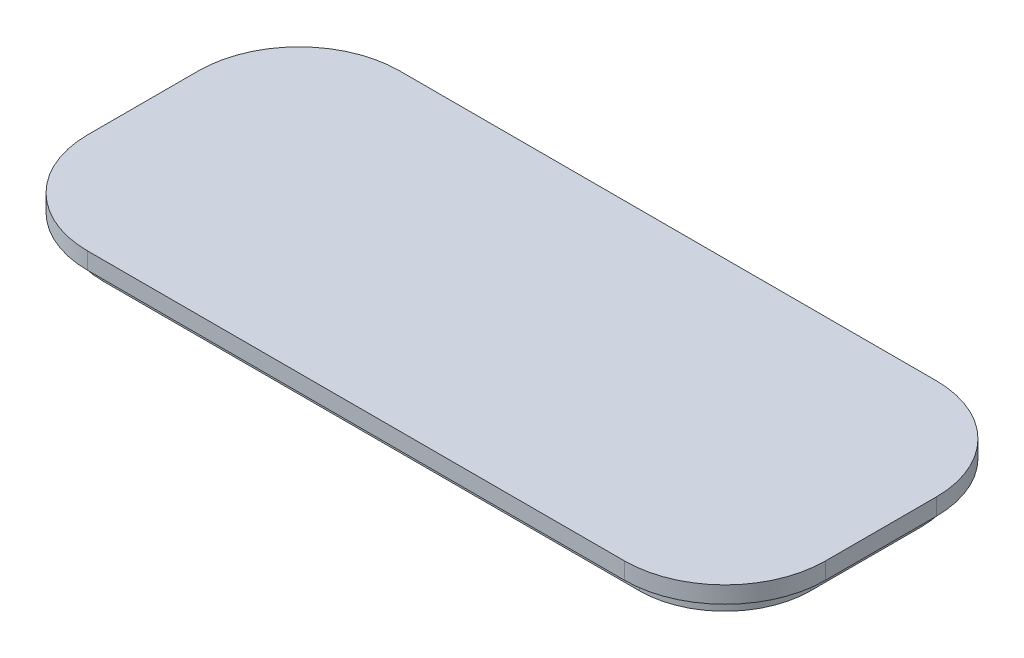
from build123d import *

# Parameters (mm, degrees)
SKETCH_1_W      = 220
SKETCH_1_H      = 93
EXTRUDE_1_DEPTH = 5
FILLET_1_R      = 30
EXTRUDE_2_DEPTH = 5


with BuildPart() as part:
    # 草圖1 → 填料-伸長1 (new body)
    with BuildSketch(Plane(origin=(0, 0, 0), x_dir=(1, 0, 0), z_dir=(0, 1, 0))):
        Rectangle(SKETCH_1_W, SKETCH_1_H)
    extrude(amount=EXTRUDE_1_DEPTH)

    # 圓角1
    fillet_1_edges = [part.edges().sort_by_distance(p)[0] for p in [
        (110, 2.5, 46.5),
        (-110, 2.5, 46.5),
        (-110, 2.5, -46.5),
        (110, 2.5, -46.5),
    ]]
    fillet(fillet_1_edges, radius=FILLET_1_R)

    # 草圖2 → 填料-伸長2 (add)
    with BuildSketch(Plane.XZ):
        with BuildLine():
            Line((-80, -42), (80, -42))
            ThreePointArc((80, -42), (98.03122292, -34.53122292), (105.5, -16.5))
            Line((105.5, -16.5), (105.5, 16.5))
            ThreePointArc((105.5, 16.5), (98.03122292, 34.53122292), (80, 42))
            Line((80, 42), (-80, 42))
            ThreePointArc((-80, 42), (-98.03122292, 34.53122292), (-105.5, 16.5))
            Line((-105.5, 16.5), (-105.5, -16.5))
            ThreePointArc((-105.5, -16.5), (-98.03122292, -34.53122292), (-80, -42))
        make_face()
        with BuildLine():
            Line((-80, -36.5), (80, -36.5))
            ThreePointArc((80, -36.5), (94.142135624, -30.642135624), (100, -16.5))
            Line((100, -16.5), (100, 16.5))
            ThreePointArc((100, 16.5), (94.142135624, 30.642135624), (80, 36.5))
            Line((80, 36.5), (-80, 36.5))
            ThreePointArc((-80, 36.5), (-94.142135624, 30.642135624), (-100, 16.5))
            Line((-100, 16.5), (-100, -16.5))
            ThreePointArc((-100, -16.5), (-94.142135624, -30.642135624), (-80, -36.5))
        make_face(mode=Mode.SUBTRACT)
    extrude(amount=EXTRUDE_2_DEPTH)


solid = part.part
